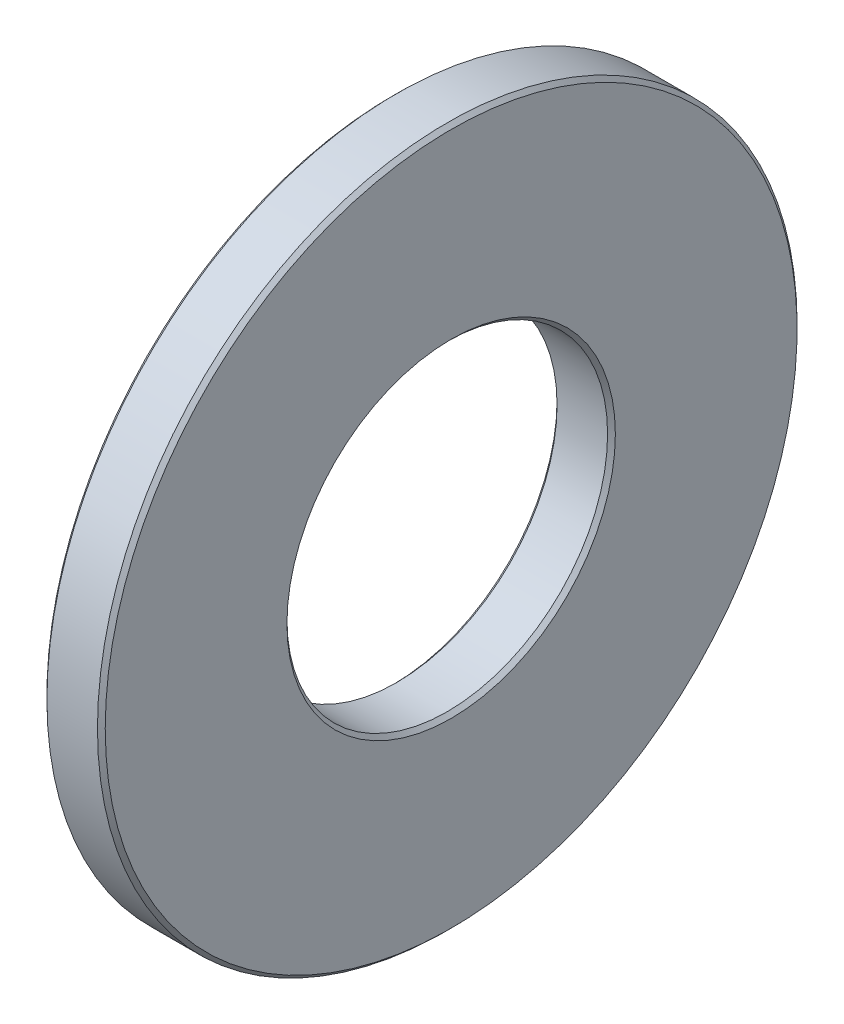
from build123d import *

# Parameters (mm, degrees)
ESQUISSE1_W     = 1.5
ESQUISSE1_H     = 4.875
CHANFREIN1_SIZE = 0.1


with BuildPart() as part:
    # Esquisse1 → Base-Révolution (revolve)
    with BuildSketch(Plane.XY, mode=Mode.PRIVATE) as base_r_volution_sk:
        with Locations((0.75, 6.5625)):
            Rectangle(ESQUISSE1_W, ESQUISSE1_H)
    revolve(base_r_volution_sk.sketch.rotate(Axis((0, 0, 0), (1, 0, 0)), 270), axis=Axis((0, 0, 0), (1, 0, 0)))

    # Chanfrein1
    chanfrein1_edges = [part.edges().sort_by_distance(p)[0] for p in [
        (0, 0, 4.125),
        (1.5, 0, 4.125),
        (1.5, 0, 9),
        (0, 0, 9),
    ]]
    chamfer(chanfrein1_edges, length=CHANFREIN1_SIZE)


solid = part.part
